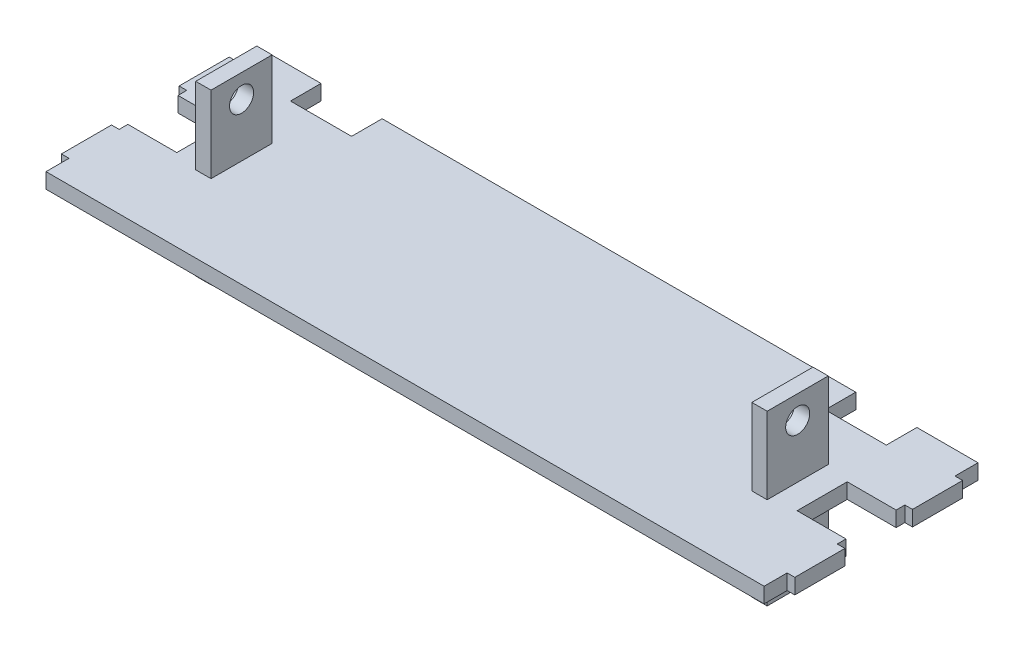
from build123d import *

# Parameters (mm, degrees)
BOSS_EXTRUDE1_DEPTH     = 3.175
SKETCH2_W               = 6.35
SKETCH2_H               = 25.4
BOSS_EXTRUDE2_DEPTH     = 35.052
CUT_EXTRUDE1_DEPTH      = 277.991076082
CUT_EXTRUDE1_DEPTH_BACK = 277.991076082
SKETCH5_R               = 5.0038


with BuildPart() as part:
    # Sketch1 → Boss-Extrude1 (new, symmetric)
    with BuildSketch(Plane(origin=(0, 0, 0), x_dir=(1, 0, 0), z_dir=(0, 1, 0))):
        Polygon((149.225, -44.45), (-149.225, -44.45), (-149.225, -34.874677354), (-152.4, -34.874677354), (-152.4, -14.046677354), (-149.225, -14.046677354), (-149.225, -10.414), (-128.905, -10.414), (-128.905, 10.414), (-149.225, 10.414), (-149.225, 14.046677354), (-152.4, 14.046677354), (-152.4, 34.874677354), (-149.225, 34.874677354), (-149.225, 44.45), (-123.825, 44.45), (-123.825, 31.75), (-98.425, 31.75), (-98.425, 44.45), (98.425, 44.45), (98.425, 31.75), (123.825, 31.75), (123.825, 44.45), (149.225, 44.45), (149.225, 34.874677354), (152.4, 34.874677354), (152.4, 14.046677354), (149.225, 14.046677354), (149.225, 10.414), (128.905, 10.414), (128.905, -10.414), (149.225, -10.414), (149.225, -14.046677354), (152.4, -14.046677354), (152.4, -34.874677354), (149.225, -34.874677354), align=None)
    extrude(amount=BOSS_EXTRUDE1_DEPTH, both=True)

    # Sketch2 → Boss-Extrude2 (add, symmetric)
    with BuildSketch(Plane(origin=(0, 0, 0), x_dir=(1, 0, 0), z_dir=(0, 1, 0))):
        with Locations((115.57, 0)):
            Rectangle(SKETCH2_W, SKETCH2_H)
        with Locations((-115.57, 0)):
            Rectangle(SKETCH2_W, SKETCH2_H)
    extrude(amount=BOSS_EXTRUDE2_DEPTH, both=True)

    # Sketch5 → Cut-Extrude1 (cut, two sides: drawn at the far end of the back side and taken through both)
    with BuildSketch(Plane.ZY.offset(118.745).offset(-CUT_EXTRUDE1_DEPTH_BACK)):
        with Locations((0, 25.4)):
            Circle(SKETCH5_R)
        with Locations((0, -25.4)):
            Circle(SKETCH5_R)
    extrude(amount=CUT_EXTRUDE1_DEPTH + CUT_EXTRUDE1_DEPTH_BACK, mode=Mode.SUBTRACT)


solid = part.part
